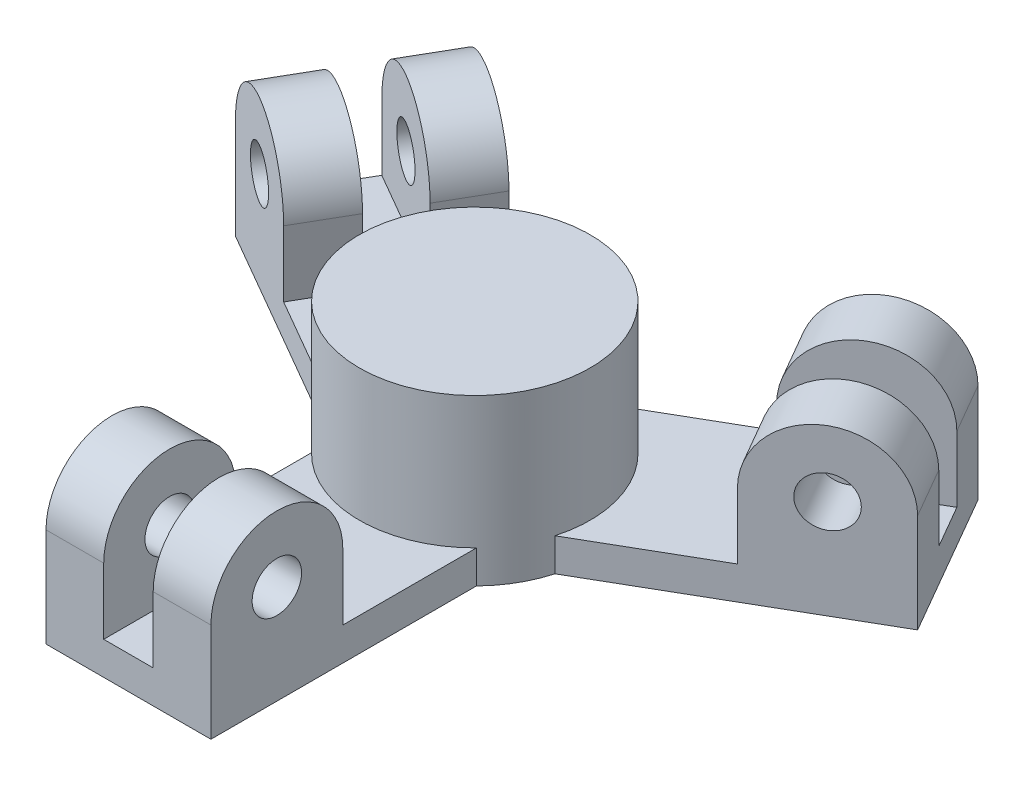
from build123d import *

# Parameters (mm, degrees)
SKETCH1_R           = 7
BOSS_EXTRUDE1_DEPTH = 10
SKETCH2_W           = 10
SKETCH2_H           = 21
BOSS_EXTRUDE2_DEPTH = 2
SKETCH3_W           = 3.5
SKETCH3_H           = 8
BOSS_EXTRUDE3_DEPTH = 8
CUT_EXTRUDE1_DEPTH  = 27.172504657
SKETCH5_R           = 1.5
CUT_EXTRUDE2_DEPTH  = 27.172504657
CIRPATTERN1_COUNT   = 3


with BuildPart() as part:
    # Sketch1 → Boss-Extrude1 (new body)
    with BuildSketch(Plane(origin=(0, 0, 0), x_dir=(1, 0, 0), z_dir=(0, 1, 0))):
        with Locations(Location((0, 0, 0), (0, 0, 270))):
            Circle(SKETCH1_R)
    extrude(amount=BOSS_EXTRUDE1_DEPTH)

    # Sketch2 → Boss-Extrude2 (add)
    with BuildSketch(Plane.XZ):
        with Locations((0, 10.5)):
            Rectangle(SKETCH2_W, SKETCH2_H)
    boss_extrude2 = extrude(amount=-BOSS_EXTRUDE2_DEPTH)

    # Sketch3 → Boss-Extrude3 (add)
    with BuildSketch(Plane.XY.offset(21)):
        with Locations((-3.25, 6)):
            Rectangle(SKETCH3_W, SKETCH3_H)
        with Locations((3.25, 6)):
            Rectangle(SKETCH3_W, SKETCH3_H)
    boss_extrude3 = extrude(amount=-BOSS_EXTRUDE3_DEPTH)

    # Sketch4 → Cut-Extrude1 (cut, through all)
    with BuildSketch(Plane(origin=(5, 0, 0), x_dir=(0, 0, -1), z_dir=(1, 0, 0))):
        with BuildLine():
            Line((-21, 6), (-21, 11))
            Line((-21, 11), (-13, 11))
            Line((-13, 11), (-13, 6))
            ThreePointArc((-13, 6), (-17, 10), (-21, 6))
        make_face()
    cut_extrude1 = extrude(amount=-CUT_EXTRUDE1_DEPTH, mode=Mode.SUBTRACT)

    # Sketch5 → Cut-Extrude2 (cut, through all)
    with BuildSketch(Plane(origin=(5, 0, 0), x_dir=(0, 0, -1), z_dir=(1, 0, 0))):
        with Locations((-17, 6)):
            Circle(SKETCH5_R)
    cut_extrude2 = extrude(amount=-CUT_EXTRUDE2_DEPTH, mode=Mode.SUBTRACT)

    # CirPattern1: Boss-Extrude2, Boss-Extrude3, Cut-Extrude1, Cut-Extrude2 ×3 about axis
    cirpattern1_axis = Axis((0, 0, 0), (0, 1, 0))
    add([boss_extrude2.rotate(cirpattern1_axis, i * 360 / CIRPATTERN1_COUNT) for i in range(1, CIRPATTERN1_COUNT)])
    add([boss_extrude3.rotate(cirpattern1_axis, i * 360 / CIRPATTERN1_COUNT) for i in range(1, CIRPATTERN1_COUNT)])
    add([cut_extrude1.rotate(cirpattern1_axis, i * 360 / CIRPATTERN1_COUNT) for i in range(1, CIRPATTERN1_COUNT)], mode=Mode.SUBTRACT)
    add([cut_extrude2.rotate(cirpattern1_axis, i * 360 / CIRPATTERN1_COUNT) for i in range(1, CIRPATTERN1_COUNT)], mode=Mode.SUBTRACT)


solid = part.part
